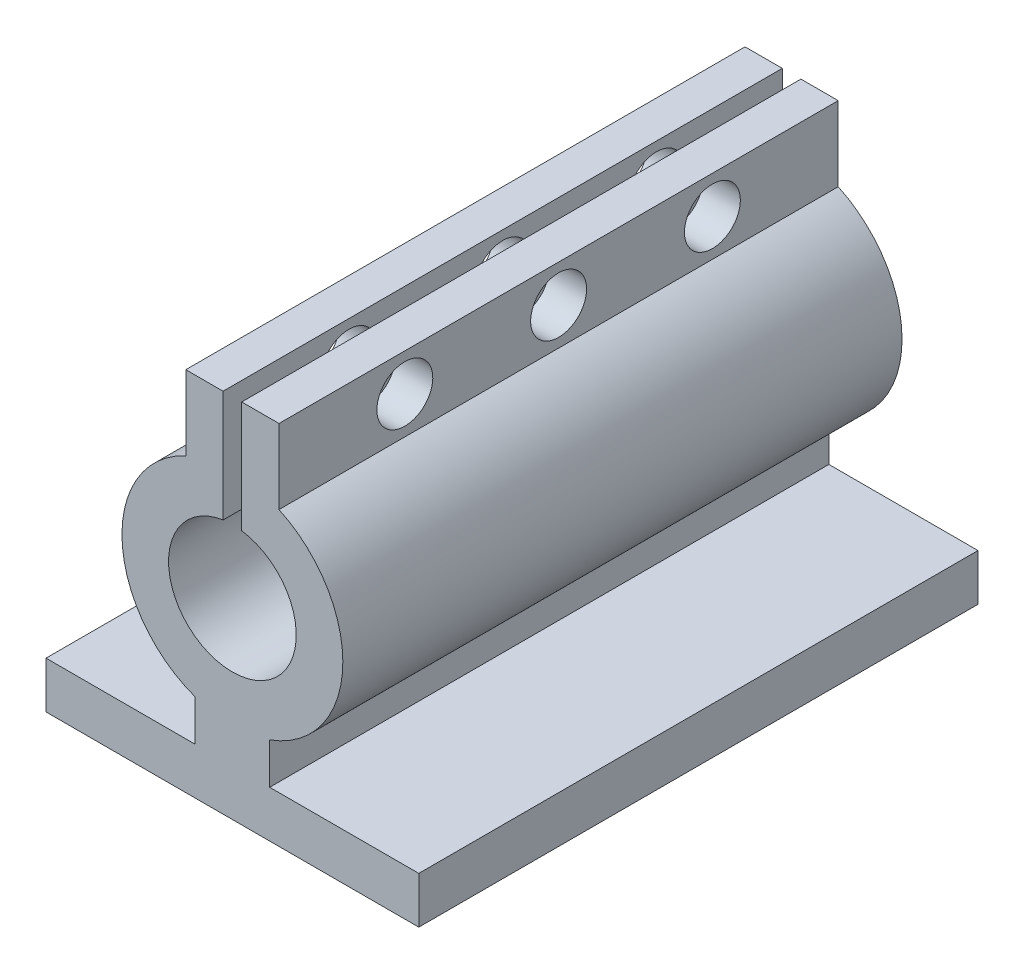
from build123d import *

# Parameters (mm, degrees)
ESQUISSE1_W             = 40
ESQUISSE1_H             = 60
BOSS_EXTRU_1_DEPTH      = 5
BOSS_EXTRU_3_DEPTH      = 60
BOSS_EXTRU_5_START      = -60
BOSS_EXTRU_5_DEPTH      = 60
ESQUISSE5_R             = 3
ENL_V_MAT_EXTRU_1_DEPTH = 76.959376992


with BuildPart() as part:
    # Esquisse1 → Boss.-Extru.1 (new body)
    with BuildSketch(Plane(origin=(0, 0, 0), x_dir=(1, 0, 0), z_dir=(0, 1, 0))):
        with Locations((20, 30)):
            Rectangle(ESQUISSE1_W, ESQUISSE1_H)
    extrude(amount=BOSS_EXTRU_1_DEPTH)

    # Esquisse3 → Boss.-Extru.3 (add)
    with BuildSketch(Plane.XY.offset(-60)):
        with BuildLine():
            Line((16, 5), (16, 15))
            ThreePointArc((16, 15), (20, 13.710800302), (24, 15))
            Line((24, 15), (24, 5))
            Line((24, 5), (16, 5))
        make_face()
    extrude(amount=BOSS_EXTRU_3_DEPTH)

    # Esquisse4 → Boss.-Extru.5 (add)
    with BuildSketch(Plane.XY.offset(BOSS_EXTRU_5_START)):
        with BuildLine():
            Line((15, 31.304286701), (15, 39.304286701))
            Line((15, 39.304286701), (19, 39.304286701))
            Line((19, 39.304286701), (19, 27.337414501))
            ThreePointArc((19, 27.337414501), (20, 13.710800302), (21, 27.337414501))
            Line((21, 27.337414501), (21, 39.304286701))
            Line((21, 39.304286701), (25, 39.304286701))
            Line((25, 39.304286701), (25, 31.304286701))
            ThreePointArc((25, 31.304286701), (20, 8.710800302), (15, 31.304286701))
        make_face()
    extrude(amount=BOSS_EXTRU_5_DEPTH)

    # Esquisse5 → Enlèv. mat.-Extru.1 (cut, through all)
    with BuildSketch(Plane(origin=(25, 0, 0), x_dir=(0, 0, -1), z_dir=(1, 0, 0))):
        with Locations(Location((13.5, 35.304286701, 0), (0, 0, 90))):
            Circle(ESQUISSE5_R)
        with Locations(Location((30, 35.304286701, 0), (0, 0, 90))):
            Circle(ESQUISSE5_R)
        with Locations(Location((46.5, 35.304286701, 0), (0, 0, 90))):
            Circle(ESQUISSE5_R)
    extrude(amount=-ENL_V_MAT_EXTRU_1_DEPTH, mode=Mode.SUBTRACT)


solid = part.part
